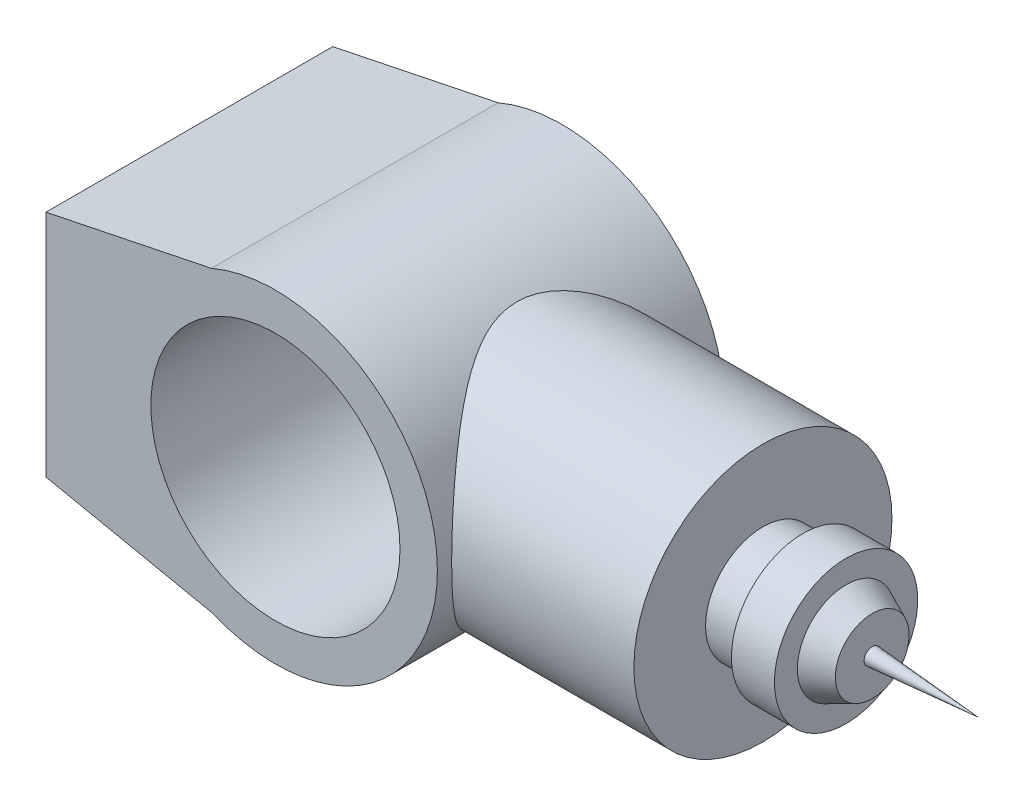
from build123d import *

# Parameters (mm, degrees)
SKETCH2_R                = 43.44469048
BOSS_EXTRUDE1_DEPTH      = 50
BOSS_EXTRUDE2_REACH      = 215.752
BOSS_EXTRUDE2_END_RADIUS = 56.480159791
SKETCH3_R                = 45


with BuildPart() as part:
    # Sketch2 → Boss-Extrude1 (new, symmetric)
    with BuildSketch(Plane.XY):
        with BuildLine():
            Line((-80, -40), (-80, 40))
            Line((-80, 40), (-22.346361777, 51.871461955))
            ThreePointArc((-22.346361777, 51.871461955), (56.479460907, 0.280972569), (-21.829170875, -52.091225258))
            Line((-21.829170875, -52.091225258), (-80, -40))
        make_face()
        Circle(SKETCH2_R, mode=Mode.SUBTRACT)
    extrude(amount=BOSS_EXTRUDE1_DEPTH, both=True)

    # Boss-Extrude2: up to this cylinder (the profile starts outside it)
    boss_extrude2_end = Plane(origin=(0, 0, 0), z_dir=(0, 0, -1)) * Cylinder(BOSS_EXTRUDE2_END_RADIUS, 545.464319581, mode=Mode.PRIVATE)
    # Sketch3 → Boss-Extrude2 (add, up to the surface)
    with BuildSketch(Plane(origin=(120, 0, 0), x_dir=(0, 0, -1), z_dir=(1, 0, 0)), mode=Mode.PRIVATE) as boss_extrude2_sk1:
        Circle(SKETCH3_R)
    boss_extrude2_tool1 = extrude(boss_extrude2_sk1.sketch, amount=-BOSS_EXTRUDE2_REACH, mode=Mode.PRIVATE) - boss_extrude2_end
    add(boss_extrude2_tool1.solids().sort_by_distance((120, 0, 0))[0])

    # Sketch4 → Revolve1 (revolve)
    with BuildSketch(Plane.XY, mode=Mode.PRIVATE) as revolve1_sk:
        Polygon((120, 0), (120, -20), (134, -20), (134, -25), (149, -25), (149, -16.982971646), (158.108949035, -12.856587336), (158.108949035, -2.837315404), (195, 0), align=None)
    revolve(revolve1_sk.sketch.rotate(Axis((0, 0, 0), (1, 0, 0)), 270), axis=Axis((0, 0, 0), (1, 0, 0)))


solid = part.part
